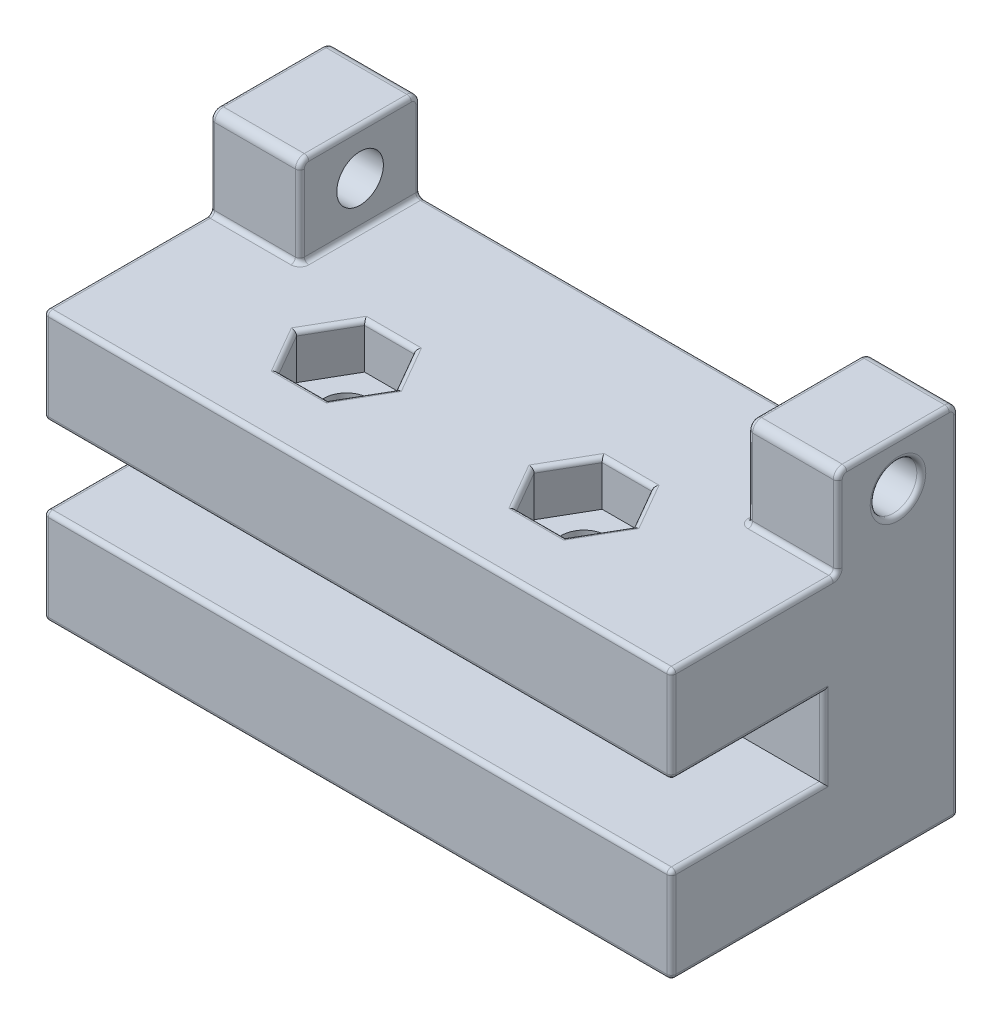
from build123d import *

# Parameters (mm, degrees)
SKETCH1_W            = 30
SKETCH1_H            = 30
SKETCH1_W_2          = 6
SKETCH1_H_2          = 3
SKETCH1_W_3          = 11.5
SKETCH1_H_3          = 1
BOSS_EXTRUDE1_DEPTH  = 32
SKETCH5_W            = 32
SKETCH5_H            = 0.085008
SKETCH5_H_2          = 10.539992
BOSS_EXTRUDE3_DEPTH  = 20
SKETCH6_R            = 2.525
CUT_EXTRUDE3_DEPTH   = 57.115951386
SKETCH14_R           = 2.6
BOSS_EXTRUDE9_DEPTH  = 10
SKETCH7_W            = 10.179800835
SKETCH7_H            = 8.75
CUT_EXTRUDE5_DEPTH   = 65.412731661
SKETCH18_W           = 15
SKETCH18_H           = 8.75
BOSS_EXTRUDE12_DEPTH = 70
BOSS_EXTRUDE13_DEPTH = 22.13
CUT_EXTRUDE6_DEPTH   = 9.87
CUT_EXTRUDE7_START   = -4.375
SKETCH21_R           = 10
CUT_EXTRUDE7_DEPTH   = 8.75
SKETCH23_R           = 2.525
CUT_EXTRUDE9_DEPTH   = 57.115951386
SKETCH24_W           = 40.820508076
SKETCH24_H           = 8.75
CUT_EXTRUDE10_DEPTH  = 54.609700615
FILLET2_R            = 0.5
SKETCH29_R           = 3.025
SKETCH29_R_2         = 2.525
CUT_EXTRUDE11_DEPTH  = 5
FILLET3_R            = 0.5
FILLET3_OF_MIRROR4_R = 0.5
FILLET4_R            = 1


with BuildPart() as part:
    # Sketch1 → Boss-Extrude1 (new body)
    # profile 1 of 7: a face of its own
    with BuildSketch(Plane.XY):
        Rectangle(SKETCH1_W, SKETCH1_H)
        Polygon((-11, 11), (-2.875, 11), (3.125, 11), (11, 11), (11, -11), (3.125, -11), (-2.875, -11), (-11, -11), align=None, mode=Mode.SUBTRACT)
    # profile 2 of 7: a face of its own
    with BuildSketch(Plane.XY):
        with Locations((0.125, 9.5)):
            Rectangle(SKETCH1_W_2, SKETCH1_H_2)
    # profile 3 of 7: a face of its own
    with BuildSketch(Plane.XY):
        with Locations((0.026238522, 7.5)):
            Rectangle(SKETCH1_W_3, SKETCH1_H_3)
    # profile 4 of 7: a face of its own
    with BuildSketch(Plane.XY):
        Polygon((-3, 4.1), (2.9, 4.1), (5.776238522, 7), (-5.723761478, 7), align=None)
    # profile 5 of 7: a face of its own
    with BuildSketch(Plane.XY):
        Polygon((5.776238522, -7), (-5.723761478, -7), (-3, -4.1), (2.9, -4.1), align=None)
    # profile 6 of 7: a face of its own
    with BuildSketch(Plane.XY):
        with Locations((0.026238522, -7.5)):
            Rectangle(SKETCH1_W_3, SKETCH1_H_3)
    # profile 7 of 7: a face of its own
    with BuildSketch(Plane.XY):
        with Locations((0.125, -9.5)):
            Rectangle(SKETCH1_W_2, SKETCH1_H_2)
    extrude(amount=BOSS_EXTRUDE1_DEPTH)

    # Sketch5 → Boss-Extrude3 (add)
    with BuildSketch(Plane.ZY.offset(15)):
        with Locations((16, 4.417504)):
            Rectangle(SKETCH5_W, SKETCH5_H)
        with Locations((16, 9.730004)):
            Rectangle(SKETCH5_W, SKETCH5_H_2)
        with Locations((16, -4.417504)):
            Rectangle(SKETCH5_W, SKETCH5_H)
        with Locations((16, -9.730004)):
            Rectangle(SKETCH5_W, SKETCH5_H_2)
    boss_extrude3 = extrude(amount=BOSS_EXTRUDE3_DEPTH)

    # Sketch6 → Cut-Extrude3 (cut, through all)
    with BuildSketch(Plane(origin=(0, 15, 0), x_dir=(1, 0, 0), z_dir=(0, 1, 0))):
        with Locations(Location((-13.25, -20, 0), (0, 0, 270))):
            Circle(SKETCH6_R)
    cut_extrude3 = extrude(amount=-CUT_EXTRUDE3_DEPTH, mode=Mode.SUBTRACT)

    # Mirror1: Boss-Extrude3, Cut-Extrude3 across plane
    add(boss_extrude3.mirror(Plane(origin=(0, 0, 0), x_dir=(0, 0, 1), z_dir=(1, 0, 0))))
    add(cut_extrude3.mirror(Plane(origin=(0, 0, 0), x_dir=(0, 0, 1), z_dir=(1, 0, 0))), mode=Mode.SUBTRACT)

    # Sketch14 → Boss-Extrude9 (add)
    with BuildSketch(Plane.ZY.offset(35)):
        with BuildLine():
            Line((0, 24), (0, 15))
            Line((0, 15), (13.438100892, 15))
            Line((13.438100892, 15), (13.438100892, 24))
            ThreePointArc((13.438100892, 24), (13.145207674, 24.707106781), (12.438100892, 25))
            Line((12.438100892, 25), (1, 25))
            ThreePointArc((1, 25), (0.292893219, 24.707106781), (0, 24))
        make_face()
        with Locations(Location((6.719050446, 20, 0), (0, 0, 270))):
            Circle(SKETCH14_R, mode=Mode.SUBTRACT)
    boss_extrude9 = extrude(amount=-BOSS_EXTRUDE9_DEPTH)

    # Mirror2: Boss-Extrude9 across plane
    add(boss_extrude9.mirror(Plane(origin=(0, 0, 0), x_dir=(0, 0, 1), z_dir=(1, 0, 0))))

    # Sketch7 → Cut-Extrude5 (cut, through all)
    with BuildSketch(Plane.ZY.offset(15)):
        with Locations((26.910099583, 0)):
            Rectangle(SKETCH7_W, SKETCH7_H)
    extrude(amount=-CUT_EXTRUDE5_DEPTH, mode=Mode.SUBTRACT)

    # Sketch18 → Boss-Extrude12 (add, through all)
    with BuildSketch(Plane.ZY.offset(35)):
        with Locations((7.5, 0)):
            Rectangle(SKETCH18_W, SKETCH18_H)
    extrude(amount=-BOSS_EXTRUDE12_DEPTH)

    # Sketch19 → Boss-Extrude13 (add)
    with BuildSketch(Plane.XY.offset(32)):
        Polygon((-3.258287726, -4.375), (-11, -4.375), (-11, -11), (-2.875, -11), (-2.875, -8), (-5.723761478, -8), (-5.723761478, -7), align=None)
        Polygon((11, -4.375), (3.172746756, -4.375), (5.776238522, -7), (5.776238522, -8), (3.125, -8), (3.125, -11), (11, -11), align=None)
        Polygon((5.776238522, 7), (3.172746756, 4.375), (11, 4.375), (11, 11), (3.125, 11), (3.125, 8), (5.776238522, 8), align=None)
        Polygon((-11, 11), (-11, 4.375), (-3.258287726, 4.375), (-5.723761478, 7), (-5.723761478, 8), (-2.875, 8), (-2.875, 11), align=None)
    extrude(amount=-BOSS_EXTRUDE13_DEPTH)

    # Sketch20 → Cut-Extrude6 (cut)
    with BuildSketch(Plane(origin=(0, 0, 0), x_dir=(-1, 0, 0), z_dir=(0, 0, -1))):
        Polygon((-3.172746756, 4.375), (-11, 4.375), (-11, -4.375), (-3.172746756, -4.375), (3.258287726, -4.375), (11, -4.375), (11, 4.375), (3.258287726, 4.375), align=None)
    extrude(amount=-CUT_EXTRUDE6_DEPTH, mode=Mode.SUBTRACT)

    # Sketch21 → Cut-Extrude7 (cut)
    with BuildSketch(Plane(origin=(0, 0, 0), x_dir=(1, 0, 0), z_dir=(0, 1, 0)).offset(CUT_EXTRUDE7_START)):
        with Locations((-11.75, -20)):
            Circle(SKETCH21_R)
    cut_extrude7 = extrude(amount=CUT_EXTRUDE7_DEPTH, mode=Mode.SUBTRACT)

    # Mirror3: Cut-Extrude7 across plane
    add(cut_extrude7.mirror(Plane(origin=(0, 0, 0), x_dir=(0, 0, 1), z_dir=(1, 0, 0))), mode=Mode.SUBTRACT)

    # Sketch23 → Cut-Extrude9 (cut, through all)
    with BuildSketch(Plane(origin=(0, 15, 0), x_dir=(1, 0, 0), z_dir=(0, 1, 0))):
        with BuildLine():
            ThreePointArc((-10.725, -20), (-10.794712339, -19.410773813), (-11, -18.854083336))
            Line((-11, -18.854083336), (-11, -21.145916664))
            ThreePointArc((-11, -21.145916664), (-10.794712339, -20.589226187), (-10.725, -20))
        make_face()
        with BuildLine():
            Line((-11, -21.145916664), (-11, -18.854083336))
            ThreePointArc((-11, -18.854083336), (-15.775, -20), (-11, -21.145916664))
        make_face()
        with Locations(Location((13.25, -20, 0), (0, 0, 270))):
            Circle(SKETCH23_R)
    extrude(amount=-CUT_EXTRUDE9_DEPTH, mode=Mode.SUBTRACT)

    # Sketch24 → Cut-Extrude10 (cut, through all)
    with BuildSketch(Plane.XY.offset(32)):
        Rectangle(SKETCH24_W, SKETCH24_H)
    extrude(amount=-CUT_EXTRUDE10_DEPTH, mode=Mode.SUBTRACT)

    # Fillet2
    fillet2_edges = [part.edges().sort_by_distance(p)[0] for p in [
        (0, 15, 32),
        (0, 4.375, 32),
        (-35, 9.6875, 32),
        (-35, 15, 22.719050446),
        (-35, 4.5, 0),
        (0, -4.375, 32),
        (-35, -15, 16),
        (-35, -9.6875, 32),
        (-13.25, 15, 17.475),
        (35, 9.6875, 32),
        (35, 4.5, 0),
        (35, 15, 22.719050446),
        (35, -9.6875, 32),
        (35, -15, 16),
        (13.25, 15, 17.475),
        (0, 15, 0),
        (-25, 19.5, 13.438100892),
        (-30, 15, 13.438100892),
        (-25, 19.5, 0),
        (-25, 24.707106781, 0.292893219),
        (-25, 25, 6.719050446),
        (-35, 22.6, 6.719050446),
        (-25, 24.707106781, 13.145207674),
        (-25, 15, 6.719050446),
        (-35, 19.5, 13.438100892),
        (-35, 24.707106781, 13.145207674),
        (-35, 25, 6.719050446),
        (-35, 24.707106781, 0.292893219),
        (0, -15, 32),
        (35, 19.5, 13.438100892),
        (30, 15, 13.438100892),
        (35, 24.707106781, 13.145207674),
        (35, 25, 6.719050446),
        (35, 24.707106781, 0.292893219),
        (25, 15, 6.719050446),
        (25, 19.5, 13.438100892),
        (25, 24.707106781, 13.145207674),
        (25, 25, 6.719050446),
        (25, 24.707106781, 0.292893219),
        (25, 19.5, 0),
        (35, 22.6, 6.719050446),
        (-11, 7.6875, 0),
        (35, -4.375, 23.5),
        (-6.9375, -11, 0),
        (35, 4.375, 23.5),
        (-35, -4.375, 23.5),
        (-35, 4.375, 23.5),
        (4.474492639, -5.6875, 0),
        (-2.875, -9.5, 0),
        (4.474492639, 5.6875, 0),
        (-4.299380739, -8, 0),
        (-5.723761478, -7.5, 0),
        (-4.491024602, -5.6875, 0),
        (35, 0, 15),
        (-35, 0, 15),
        (5.776238522, -7.5, 0),
        (4.450619261, -8, 0),
        (3.125, -9.5, 0),
        (7.0625, -11, 0),
        (11, 7.6875, 0),
        (7.0625, 11, 0),
        (3.125, 9.5, 0),
        (4.450619261, 8, 0),
        (5.776238522, 7.5, 0),
        (-4.491024602, 5.6875, 0),
        (-5.723761478, 7.5, 0),
        (-4.299380739, 8, 0),
        (-2.875, 9.5, 0),
        (-6.9375, 11, 0),
        (0, -15, 0),
        (-0.042770485, -4.375, 0),
        (-0.042770485, 4.375, 0),
        (11, -7.6875, 0),
        (-11, -7.6875, 0),
        (15.705127019, 4.375, 0),
        (20.410254038, 0, 0),
        (-20.410254038, 0, 0),
        (15.705127019, -4.375, 0),
        (-15.705127019, -4.375, 0),
        (-15.705127019, 4.375, 0),
    ]]
    fillet(fillet2_edges, radius=FILLET2_R)

    # Sketch29 → Cut-Extrude11 (cut)
    # profile 1 of 3: a face of its own
    with BuildSketch(Plane(origin=(0, 15, 0), x_dir=(1, 0, 0), z_dir=(0, 1, 0))):
        Polygon((-18.80625, -20), (-16.028125, -24.81185365), (-10.471875, -24.81185365), (-7.69375, -20), (-10.471875, -15.18814635), (-16.028125, -15.18814635), align=None)
        with Locations((-13.25, -20)):
            Circle(SKETCH29_R, mode=Mode.SUBTRACT)
    # profile 2 of 3: a face of its own
    with BuildSketch(Plane(origin=(0, 15, 0), x_dir=(1, 0, 0), z_dir=(0, 1, 0))):
        with Locations((-13.25, -20)):
            Circle(SKETCH29_R)
        with Locations(Location((-13.25, -20, 0), (0, 0, 270))):
            Circle(SKETCH29_R_2, mode=Mode.SUBTRACT)
    # profile 3 of 3: a face of its own
    with BuildSketch(Plane(origin=(0, 15, 0), x_dir=(1, 0, 0), z_dir=(0, 1, 0))):
        with Locations((-13.25, -20)):
            Circle(SKETCH29_R)
    cut_extrude11 = extrude(amount=-CUT_EXTRUDE11_DEPTH, mode=Mode.SUBTRACT)

    # Fillet3
    fillet3_edges = [part.edges().sort_by_distance(p)[0] for p in [
        (-17.4171875, 15, 22.405926825),
        (-13.25, 15, 24.81185365),
        (-9.0828125, 15, 22.405926825),
        (-9.0828125, 15, 17.594073175),
        (-13.25, 15, 15.18814635),
        (-17.4171875, 15, 17.594073175),
    ]]
    fillet(fillet3_edges, radius=FILLET3_R)

    # Mirror4: Cut-Extrude11 across plane
    add(cut_extrude11.mirror(Plane(origin=(0, 0, 0), x_dir=(0, 0, 1), z_dir=(1, 0, 0))), mode=Mode.SUBTRACT)

    # Fillet3 of Mirror4
    fillet3_of_mirror4_edges = [part.edges().sort_by_distance(p)[0] for p in [
        (17.4171875, 15, 22.405926825),
        (13.25, 15, 24.81185365),
        (9.0828125, 15, 22.405926825),
        (9.0828125, 15, 17.594073175),
        (13.25, 15, 15.18814635),
        (17.4171875, 15, 17.594073175),
    ]]
    fillet(fillet3_of_mirror4_edges, radius=FILLET3_OF_MIRROR4_R)

    # Fillet4
    fillet4_edges = [part.edges().sort_by_distance(p)[0] for p in [
        (-20.410254038, 0, 15),
        (20.410254038, 0, 15),
    ]]
    fillet(fillet4_edges, radius=FILLET4_R)


solid = part.part
